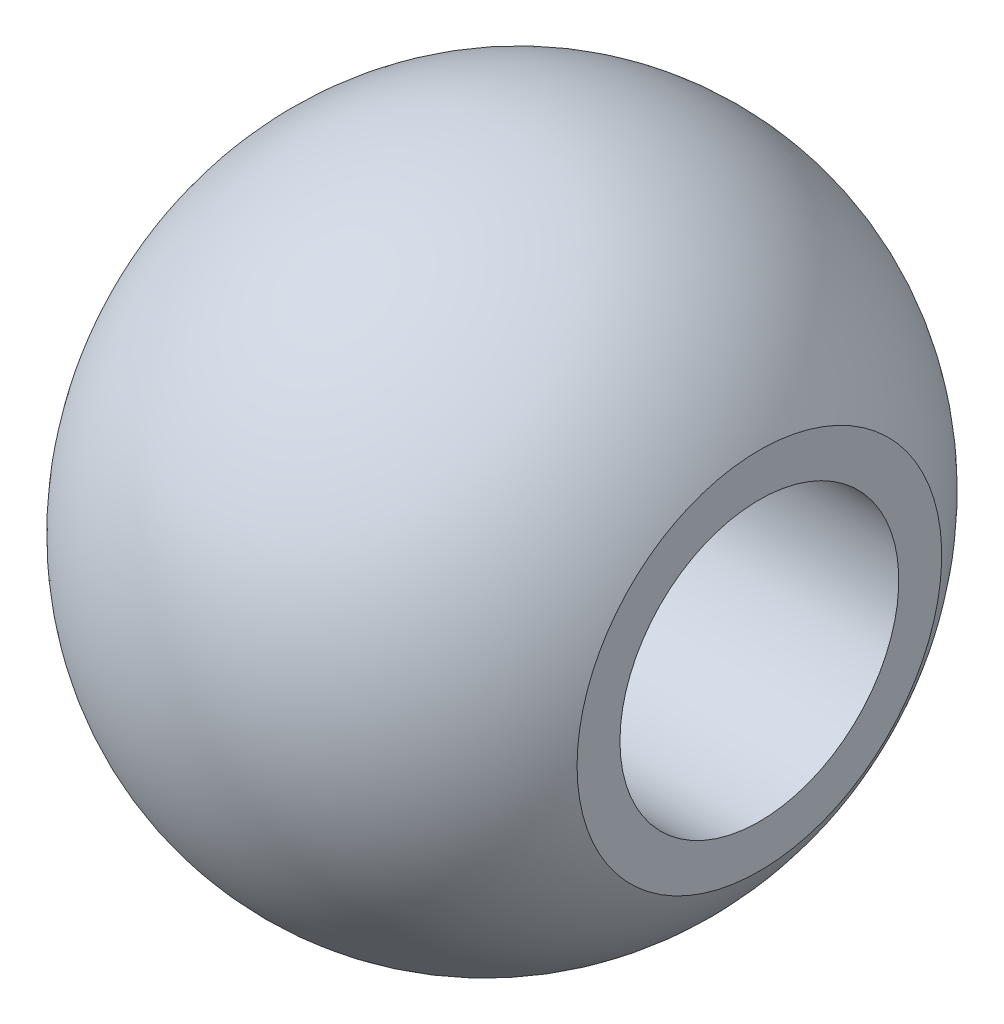
from build123d import *

# Parameters (mm, degrees)
SKETCH3_R          = 3.25
CUT_EXTRUDE1_DEPTH = 12


with BuildPart() as part:
    # Sketch2 → Revolve1 (revolve)
    with BuildSketch(Plane(origin=(0, 0, 0), x_dir=(1, 0, 0), z_dir=(0, 1, 0)), mode=Mode.PRIVATE) as revolve1_sk:
        with BuildLine():
            Line((-6, 4.25), (-6, 0))
            Line((-6, 0), (6, 0))
            Line((6, 0), (6, 4.25))
            ThreePointArc((6, 4.25), (0, 7.760450854), (-6, 4.25))
        make_face()
    revolve(revolve1_sk.sketch.rotate(Axis((-9.049218589, 0, 0), (1, 0, 0)), 180), axis=Axis((-9.049218589, 0, 0), (1, 0, 0)))

    # Sketch3 → Cut-Extrude1 (cut)
    with BuildSketch(Plane.ZY.offset(6)):
        Circle(SKETCH3_R)
    extrude(amount=-CUT_EXTRUDE1_DEPTH, mode=Mode.SUBTRACT)


solid = part.part
